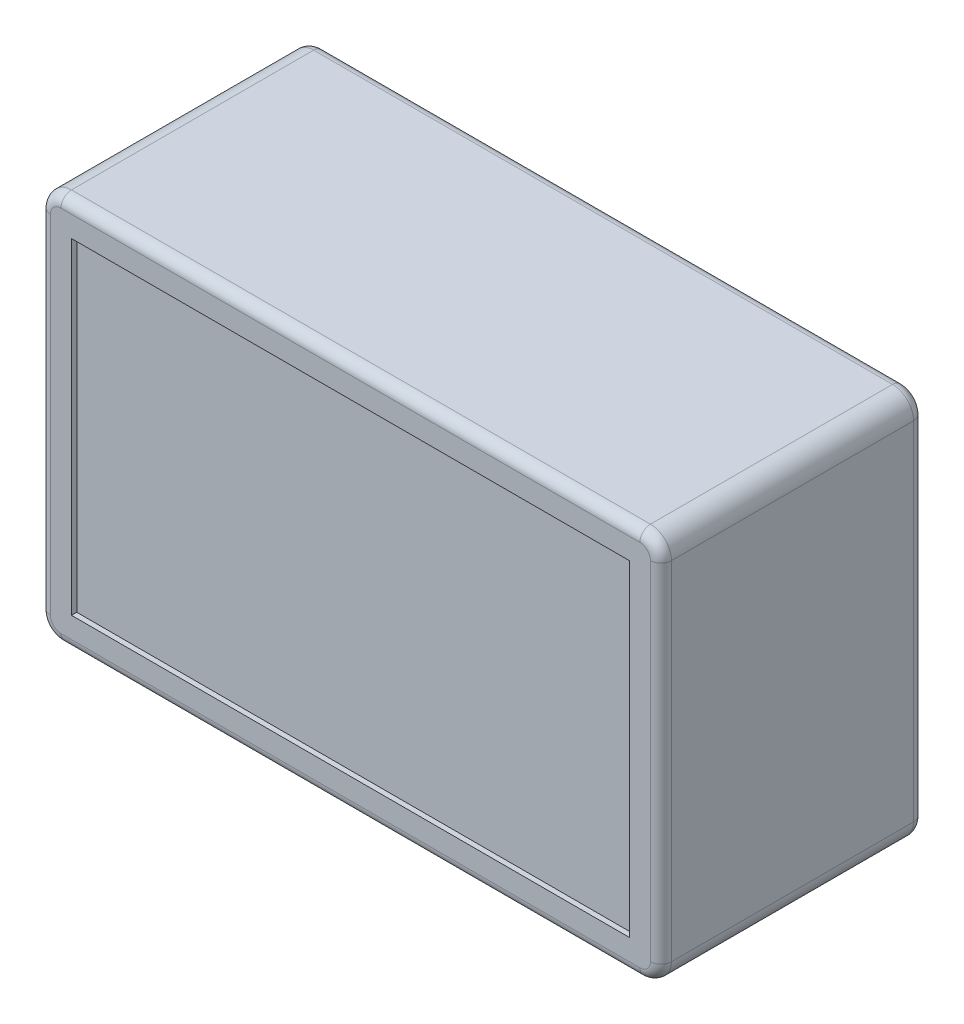
from build123d import *

# Parameters (mm, degrees)
SKETCH1_W           = 59
SKETCH1_H           = 37
BOSS_EXTRUDE1_DEPTH = 12.5
SKETCH2_R           = 7
BOSS_EXTRUDE2_DEPTH = 3
FILLET1_R           = 2
BOSS_EXTRUDE3_DEPTH = 1
SKETCH4_R           = 6
CUT_EXTRUDE1_DEPTH  = 0.5
SKETCH5_R           = 5
BOSS_EXTRUDE4_DEPTH = 2
FILLET2_R           = 1
SKETCH6_W           = 53
SKETCH6_H           = 31
CUT_EXTRUDE2_DEPTH  = 0.5


with BuildPart() as part:
    # Sketch1 → Boss-Extrude1 (new, symmetric)
    with BuildSketch(Plane.XY):
        with Locations((0, 63.5)):
            Rectangle(SKETCH1_W, SKETCH1_H)
    extrude(amount=BOSS_EXTRUDE1_DEPTH, both=True)

    # Sketch2 → Boss-Extrude2 (add)
    with BuildSketch(Plane(origin=(0, 0, -12.5), x_dir=(-1, 0, 0), z_dir=(0, 0, -1))):
        with Locations(Location((14.5, 66.5, 0), (0, 0, 180))):
            Circle(SKETCH2_R)
    extrude(amount=BOSS_EXTRUDE2_DEPTH)

    # Fillet1
    fillet1_edges = [part.edges().sort_by_distance(p)[0] for p in [
        (-29.5, 82, 0),
        (29.5, 82, 0),
        (29.5, 45, 0),
        (-29.5, 45, 0),
    ]]
    fillet(fillet1_edges, radius=FILLET1_R)

    # Sketch3 → Boss-Extrude3 (add, symmetric)
    with BuildSketch(Plane(origin=(0, 0, -12.5), x_dir=(-1, 0, 0), z_dir=(0, 0, -1))):
        with BuildLine():
            Line((5.5, 78.5), (23.5, 78.5))
            ThreePointArc((23.5, 78.5), (25.621320344, 77.621320344), (26.5, 75.5))
            Line((26.5, 75.5), (26.5, 57.5))
            ThreePointArc((26.5, 57.5), (25.621320344, 55.378679656), (23.5, 54.5))
            Line((23.5, 54.5), (5.5, 54.5))
            ThreePointArc((5.5, 54.5), (3.378679656, 55.378679656), (2.5, 57.5))
            Line((2.5, 57.5), (2.5, 75.5))
            ThreePointArc((2.5, 75.5), (3.378679656, 77.621320344), (5.5, 78.5))
        make_face()
    extrude(amount=BOSS_EXTRUDE3_DEPTH, both=True)

    # Sketch4 → Cut-Extrude1 (cut)
    with BuildSketch(Plane(origin=(0, 0, -15.5), x_dir=(-1, 0, 0), z_dir=(0, 0, -1))):
        with Locations((14.5, 66.5)):
            Circle(SKETCH4_R)
    extrude(amount=-CUT_EXTRUDE1_DEPTH, mode=Mode.SUBTRACT)

    # Sketch5 → Boss-Extrude4 (add)
    with BuildSketch(Plane(origin=(0, 0, -12.5), x_dir=(-1, 0, 0), z_dir=(0, 0, -1))):
        with Locations(Location((-17.5, 63.5, 0), (0, 0, 180))):
            Circle(SKETCH5_R)
    extrude(amount=BOSS_EXTRUDE4_DEPTH)

    # Fillet2
    fillet2_edges = [part.edges().sort_by_distance(p)[0] for p in [
        (29.5, 63.5, -12.5),
        (29.5, 63.5, 12.5),
        (-29.5, 63.5, -12.5),
        (0, 82, -12.5),
        (0, 45, -12.5),
        (-28.914213562, 81.414213562, -12.5),
        (-28.914213562, 45.585786438, -12.5),
        (28.914213562, 81.414213562, -12.5),
        (28.914213562, 45.585786438, -12.5),
        (0, 45, 12.5),
        (-29.5, 63.5, 12.5),
        (0, 82, 12.5),
        (-28.914213562, 81.414213562, 12.5),
        (-28.914213562, 45.585786438, 12.5),
        (28.914213562, 81.414213562, 12.5),
        (28.914213562, 45.585786438, 12.5),
    ]]
    fillet(fillet2_edges, radius=FILLET2_R)

    # Sketch6 → Cut-Extrude2 (cut)
    with BuildSketch(Plane.XY.offset(12.5)):
        with Locations((0, 63.5)):
            Rectangle(SKETCH6_W, SKETCH6_H)
    extrude(amount=-CUT_EXTRUDE2_DEPTH, mode=Mode.SUBTRACT)


solid = part.part
